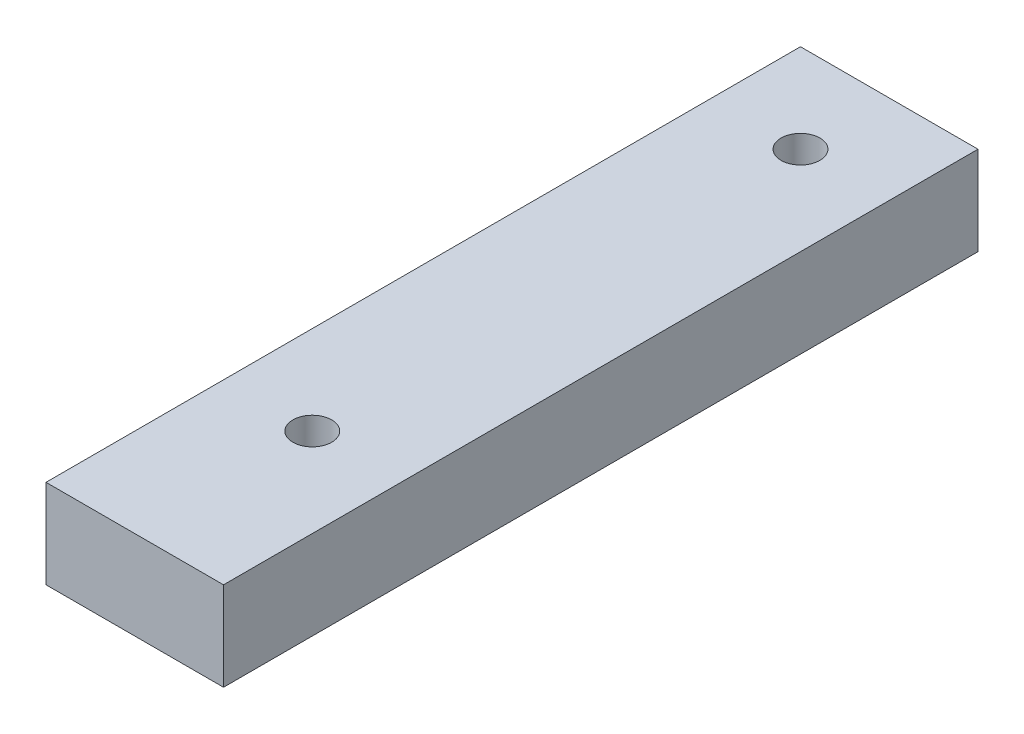
from build123d import *

# Parameters (mm, degrees)
SKETCH1_W           = 304.8
SKETCH1_H           = 304.8
BOSS_EXTRUDE1_DEPTH = 6.35
CUT_EXTRUDE2_DEPTH  = 6.35
SKETCH3_R           = 1.3890625
CUT_EXTRUDE3_DEPTH  = 306.130549929


with BuildPart() as part:
    # Sketch1 → Boss-Extrude1 (new body)
    with BuildSketch(Plane(origin=(0, 0, 0), x_dir=(1, 0, 0), z_dir=(0, 1, 0))):
        with Locations((152.4, 152.4)):
            Rectangle(SKETCH1_W, SKETCH1_H)
    extrude(amount=BOSS_EXTRUDE1_DEPTH)

    # Sketch2 → Cut-Extrude2 (cut)
    with BuildSketch(Plane(origin=(0, 6.35, 0), x_dir=(1, 0, 0), z_dir=(0, 1, 0))):
        Polygon((12.7, 304.8), (12.7, 250.825), (0, 250.825), (0, 0), (304.8, 0), (304.8, 304.8), align=None)
    extrude(amount=-CUT_EXTRUDE2_DEPTH, mode=Mode.SUBTRACT)

    # Sketch3 → Cut-Extrude3 (cut, through all)
    with BuildSketch(Plane(origin=(0, 6.35, 0), x_dir=(1, 0, 0), z_dir=(0, 1, 0))):
        with Locations(Location((6.35, 263.525, 0), (0, 0, 270))):
            Circle(SKETCH3_R)
        with Locations(Location((6.35, 298.45, 0), (0, 0, 270))):
            Circle(SKETCH3_R)
    extrude(amount=-CUT_EXTRUDE3_DEPTH, mode=Mode.SUBTRACT)


solid = part.part
